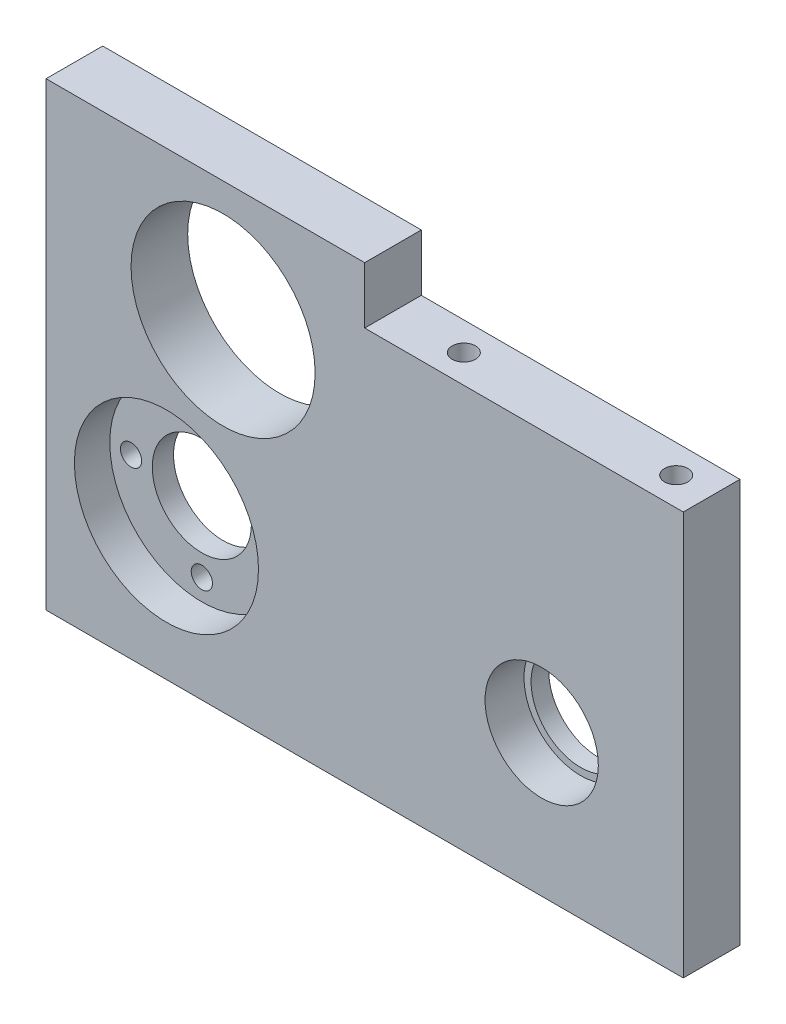
from build123d import *

# Parameters (mm, degrees)
ESQUISSE1_W             = 90
ESQUISSE1_H             = 65
ESQUISSE1_R             = 7
ESQUISSE1_R_2           = 13
BOSS_EXTRU_1_DEPTH      = 8
ESQUISSE2_R             = 13
BOSS_EXTRU_2_DEPTH      = 3
ESQUISSE3_R             = 7
ESQUISSE3_R_2           = 1.5
ENL_V_MAT_EXTRU_1_DEPTH = 112.130553854
ESQUISSE4_R             = 8
ENL_V_MAT_EXTRU_2_DEPTH = 5.5
ESQUISSE5_W             = 45
ESQUISSE5_H             = 8
ENL_V_MAT_EXTRU_3_DEPTH = 112.30588484
ESQUISSE6_R             = 1.65
ENL_V_MAT_EXTRU_4_DEPTH = 10
ESQUISSE7_R             = 1.65
ENL_V_MAT_EXTRU_5_DEPTH = 10


with BuildPart() as part:
    # Esquisse1 → Boss.-Extru.1 (new body)
    with BuildSketch(Plane.XY):
        with Locations((45, 32.5)):
            Rectangle(ESQUISSE1_W, ESQUISSE1_H)
        with Locations((70, 20)):
            Circle(ESQUISSE1_R, mode=Mode.SUBTRACT)
        with Locations((17, 20)):
            Circle(ESQUISSE1_R_2, mode=Mode.SUBTRACT)
        with Locations((25, 48)):
            Circle(ESQUISSE1_R_2, mode=Mode.SUBTRACT)
    extrude(amount=BOSS_EXTRU_1_DEPTH)

    # Esquisse2 → Boss.-Extru.2 (add)
    with BuildSketch(Plane(origin=(0, 0, 0), x_dir=(-1, 0, 0), z_dir=(0, 0, -1))):
        with Locations((-17, 20)):
            Circle(ESQUISSE2_R)
    extrude(amount=-BOSS_EXTRU_2_DEPTH)

    # Esquisse3 → Enlèv. mat.-Extru.1 (cut, through all)
    with BuildSketch(Plane.XY.offset(3)):
        with Locations((17, 20)):
            Circle(ESQUISSE3_R)
        with Locations((27, 20)):
            Circle(ESQUISSE3_R_2)
        with Locations((17, 10)):
            Circle(ESQUISSE3_R_2)
        with Locations((7, 20)):
            Circle(ESQUISSE3_R_2)
        with Locations((17, 30)):
            Circle(ESQUISSE3_R_2)
    extrude(amount=-ENL_V_MAT_EXTRU_1_DEPTH, mode=Mode.SUBTRACT)

    # Esquisse4 → Enlèv. mat.-Extru.2 (cut)
    with BuildSketch(Plane.XY.offset(8)):
        with Locations((70, 20)):
            Circle(ESQUISSE4_R)
    extrude(amount=-ENL_V_MAT_EXTRU_2_DEPTH, mode=Mode.SUBTRACT)

    # Esquisse5 → Enlèv. mat.-Extru.3 (cut, through all)
    with BuildSketch(Plane.XY.offset(8)):
        with Locations((67.5, 61)):
            Rectangle(ESQUISSE5_W, ESQUISSE5_H)
    extrude(amount=-ENL_V_MAT_EXTRU_3_DEPTH, mode=Mode.SUBTRACT)

    # Esquisse6 → Enlèv. mat.-Extru.4 (cut)
    with BuildSketch(Plane.ZY):
        with Locations((4, 7)):
            Circle(ESQUISSE6_R)
        with Locations((4, 45)):
            Circle(ESQUISSE6_R)
    extrude(amount=-ENL_V_MAT_EXTRU_4_DEPTH, mode=Mode.SUBTRACT)

    # Esquisse7 → Enlèv. mat.-Extru.5 (cut)
    with BuildSketch(Plane(origin=(0, 57, 0), x_dir=(1, 0, 0), z_dir=(0, 1, 0))):
        with Locations(Location((85, -4, 0), (0, 0, 270))):
            Circle(ESQUISSE7_R)
        with Locations(Location((55, -4, 0), (0, 0, 270))):
            Circle(ESQUISSE7_R)
    extrude(amount=-ENL_V_MAT_EXTRU_5_DEPTH, mode=Mode.SUBTRACT)


solid = part.part
